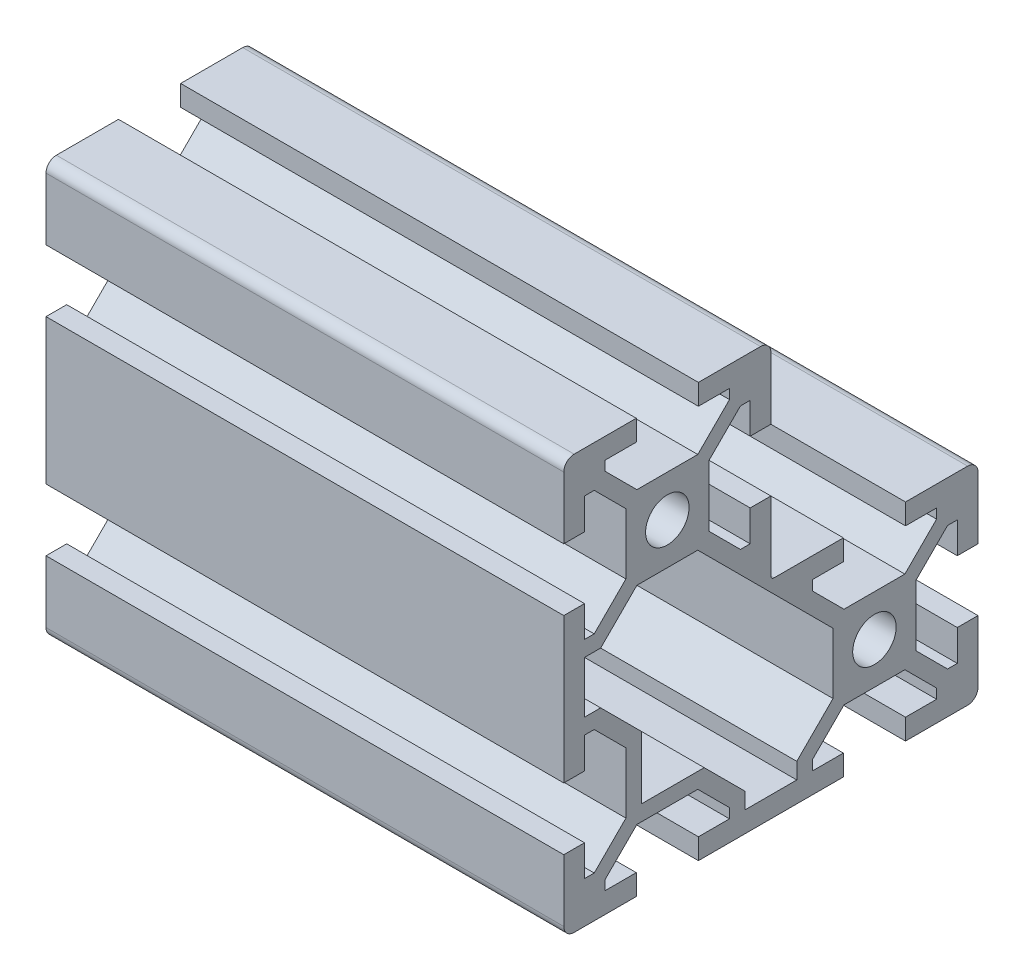
from build123d import *

# Parameters (mm, degrees)
SKETCH1_R           = 2.1
BOSS_EXTRUDE1_DEPTH = 50


with BuildPart() as part:
    # Sketch1 → Boss-Extrude1 (new body)
    with BuildSketch(Plane(origin=(0, 0, 0), x_dir=(0, 0, -1), z_dir=(1, 0, 0))):
        with BuildLine():
            Line((-13, 18), (-13, 20))
            Line((-13, 20), (-19, 20))
            ThreePointArc((-19, 20), (-19.707106781, 19.707106781), (-20, 19))
            Line((-20, 19), (-20, 13))
            Line((-20, 13), (-18, 13))
            Line((-18, 13), (-18, 16))
            Line((-18, 16), (-17.060660172, 16))
            Line((-17.060660172, 16), (-14, 12.939339828))
            Line((-14, 12.939339828), (-14, 7.060660172))
            Line((-14, 7.060660172), (-17.060660172, 4))
            Line((-17.060660172, 4), (-18, 4))
            Line((-18, 4), (-18, 7))
            Line((-18, 7), (-20, 7))
            Line((-20, 7), (-20, -7))
            Line((-20, -7), (-18, -7))
            Line((-18, -7), (-18, -4))
            Line((-18, -4), (-17.060660172, -4))
            Line((-17.060660172, -4), (-14, -7.060660172))
            Line((-14, -7.060660172), (-14, -12.939339828))
            Line((-14, -12.939339828), (-17.060660172, -16))
            Line((-17.060660172, -16), (-18, -16))
            Line((-18, -16), (-18, -13))
            Line((-18, -13), (-20, -13))
            Line((-20, -13), (-20, -19))
            ThreePointArc((-20, -19), (-19.707106781, -19.707106781), (-19, -20))
            Line((-19, -20), (-13, -20))
            Line((-13, -20), (-13, -18))
            Line((-13, -18), (-16, -18))
            Line((-16, -18), (-16, -17.060660172))
            Line((-16, -17.060660172), (-12.939339828, -14))
            Line((-12.939339828, -14), (-7.060660172, -14))
            Line((-7.060660172, -14), (-4, -17.060660172))
            Line((-4, -17.060660172), (-4, -18))
            Line((-4, -18), (-7, -18))
            Line((-7, -18), (-7, -20))
            Line((-7, -20), (7, -20))
            Line((7, -20), (7, -18))
            Line((7, -18), (4, -18))
            Line((4, -18), (4, -17.060660172))
            Line((4, -17.060660172), (7.060660172, -14))
            Line((7.060660172, -14), (12.939339828, -14))
            Line((12.939339828, -14), (16, -17.060660172))
            Line((16, -17.060660172), (16, -18))
            Line((16, -18), (13, -18))
            Line((13, -18), (13, -20))
            Line((13, -20), (19, -20))
            ThreePointArc((19, -20), (19.707106781, -19.707106781), (20, -19))
            Line((20, -19), (20, -13))
            Line((20, -13), (18, -13))
            Line((18, -13), (18, -16))
            Line((18, -16), (17.060660172, -16))
            Line((17.060660172, -16), (14, -12.939339828))
            Line((14, -12.939339828), (14, -7.060660172))
            Line((14, -7.060660172), (17.060660172, -4))
            Line((17.060660172, -4), (18, -4))
            Line((18, -4), (18, -7))
            Line((18, -7), (20, -7))
            Line((20, -7), (20, -1))
            ThreePointArc((20, -1), (19.707106781, -0.292893219), (19, 0))
            Line((19, 0), (13, 0))
            Line((13, 0), (13, -2))
            Line((13, -2), (16, -2))
            Line((16, -2), (16, -2.939339828))
            Line((16, -2.939339828), (12.939339828, -6))
            Line((12.939339828, -6), (7.060660172, -6))
            Line((7.060660172, -6), (4, -2.939339828))
            Line((4, -2.939339828), (4, -2))
            Line((4, -2), (7, -2))
            Line((7, -2), (7, 0))
            Line((7, 0), (0.3, 0))
            ThreePointArc((0.3, 0), (0.087867966, 0.087867966), (0, 0.3))
            Line((0, 0.3), (0, 7))
            Line((0, 7), (-2, 7))
            Line((-2, 7), (-2, 4))
            Line((-2, 4), (-2.939339828, 4))
            Line((-2.939339828, 4), (-6, 7.060660172))
            Line((-6, 7.060660172), (-6, 12.939339828))
            Line((-6, 12.939339828), (-2.939339828, 16))
            Line((-2.939339828, 16), (-2, 16))
            Line((-2, 16), (-2, 13))
            Line((-2, 13), (0, 13))
            Line((0, 13), (0, 19))
            ThreePointArc((0, 19), (-0.292893219, 19.707106781), (-1, 20))
            Line((-1, 20), (-7, 20))
            Line((-7, 20), (-7, 18))
            Line((-7, 18), (-4, 18))
            Line((-4, 18), (-4, 17.060660172))
            Line((-4, 17.060660172), (-7.060660172, 14))
            Line((-7.060660172, 14), (-12.939339828, 14))
            Line((-12.939339828, 14), (-16, 17.060660172))
            Line((-16, 17.060660172), (-16, 18))
            Line((-16, 18), (-13, 18))
        make_face()
        with Locations((10, -10)):
            Circle(SKETCH1_R, mode=Mode.SUBTRACT)
        with Locations((-10, 10)):
            Circle(SKETCH1_R, mode=Mode.SUBTRACT)
        Polygon((6, -7.060660172), (-7.060660172, 6), (-12.939339828, 6), (-16.439339828, 2.5), (-18, 2.5), (-18, -2.5), (-16.439339828, -2.5), (-12.5, -6.439339828), (-12.5, -12.5), (-6.439339828, -12.5), (-2.5, -16.439339828), (-2.5, -18), (2.5, -18), (2.5, -16.439339828), (6, -12.939339828), align=None, mode=Mode.SUBTRACT)
    extrude(amount=BOSS_EXTRUDE1_DEPTH)


solid = part.part
